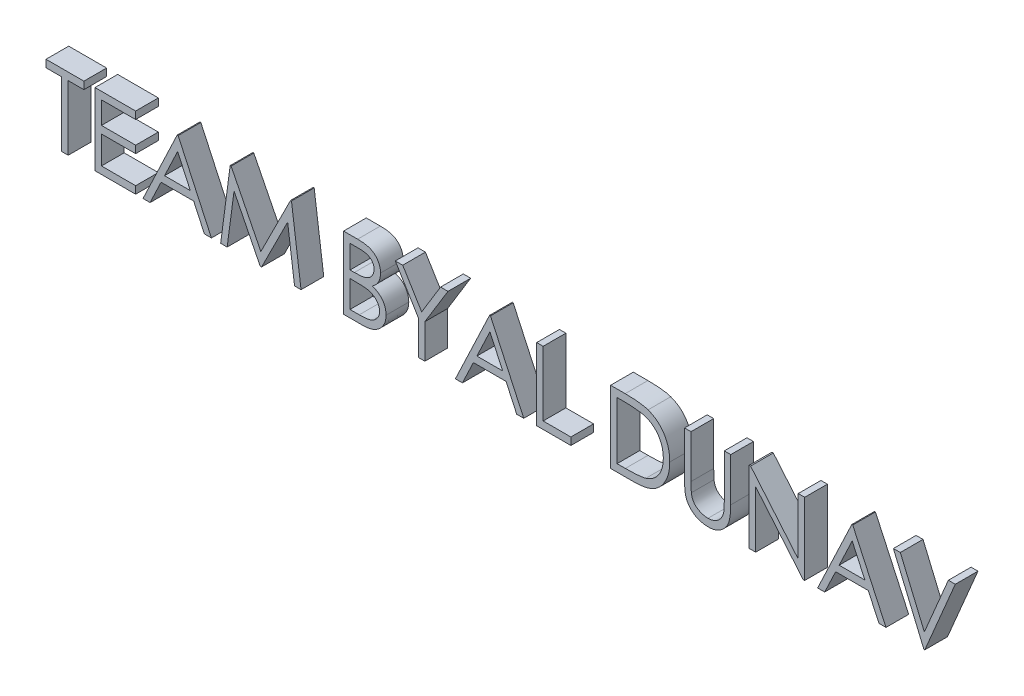
from build123d import *

# Parameters (mm, degrees)
BOSS_EXTRUDE3_DEPTH    = 3
BOSS_EXTRUDE3_2_DEPTH  = 3
BOSS_EXTRUDE3_3_DEPTH  = 3
BOSS_EXTRUDE3_4_DEPTH  = 3
BOSS_EXTRUDE3_5_DEPTH  = 3
BOSS_EXTRUDE3_6_DEPTH  = 3
BOSS_EXTRUDE3_7_DEPTH  = 3
BOSS_EXTRUDE3_8_DEPTH  = 3
BOSS_EXTRUDE3_9_DEPTH  = 3
BOSS_EXTRUDE3_10_DEPTH = 3
BOSS_EXTRUDE3_11_DEPTH = 3
BOSS_EXTRUDE3_12_DEPTH = 3
BOSS_EXTRUDE3_13_DEPTH = 3


with BuildPart() as part:
    # Sketch5 → Boss-Extrude3 (new body)
    with BuildSketch(Plane.XY):
        Polygon((51.715865385, 3.905), (52.631730769, 3.905), (55.806730769, -3.601280048), (58.981730769, 3.905), (59.897596154, 3.905), (55.867788462, -5.62), (55.745673077, -5.62), align=None)
    extrude(amount=BOSS_EXTRUDE3_DEPTH)


with BuildPart() as body_2:
    # Sketch5 → Boss-Extrude3 2 (new body)
    with BuildSketch(Plane.XY):
        Polygon((46.342788462, 3.905), (50.738942308, -5.62), (49.809720553, -5.62), (48.401577524, -2.567115385), (44.083653846, -2.567115385), (42.635441707, -5.62), (41.702403846, -5.62), (46.220673077, 3.905), align=None)
        Polygon((46.272190505, 2.048464543), (44.547310697, -1.590192308), (47.951277043, -1.590192308), align=None, mode=Mode.SUBTRACT)
    extrude(amount=BOSS_EXTRUDE3_2_DEPTH)


with BuildPart() as body_3:
    # Sketch5 → Boss-Extrude3 3 (new body)
    with BuildSketch(Plane.XY):
        Polygon((32.665865385, -5.62), (32.665865385, 3.905), (32.845222356, 3.905), (39.137980769, -3.591739784), (39.137980769, 3.905), (39.992788462, 3.905), (39.992788462, -5.62), (39.798167067, -5.62), (33.520673077, 1.859567308), (33.520673077, -5.62), align=None)
    extrude(amount=BOSS_EXTRUDE3_3_DEPTH)


with BuildPart() as body_4:
    # Sketch5 → Boss-Extrude3 4 (new body)
    with BuildSketch(Plane.XY):
        with BuildLine():
            Line((24.117788462, 3.905), (24.972596154, 3.905))
            Line((24.972596154, 3.905), (24.972596154, -1.801986178))
            add(Edge.make_bspline(
                [(24.972596154, -1.801986178), (24.972468943, -1.88276018), (24.97222754, -2.036042769), (24.973840024, -2.254215073), (24.978355877, -2.448177979), (24.981202925, -2.618679147), (24.987536597, -2.764936195), (24.992701996, -2.887741505), (24.999343797, -2.986513584), (25.007326067, -3.044155962), (25.010757212, -3.068933293)],
                knots=[0, 0, 0, 0, 1.528628734, 2.90083645, 4.128790002, 5.200304208, 6.127813768, 6.898992206, 7.526736466, 8, 8, 8, 8], degree=3))
            add(Edge.make_bspline(
                [(25.010757212, -3.068933293), (25.024847296, -3.158323414), (25.052233539, -3.332066841), (25.122028324, -3.579467236), (25.219503094, -3.802437848), (25.335008804, -4.007936433), (25.48722541, -4.190243191), (25.669570746, -4.358187046), (25.890490244, -4.505067458), (26.136128035, -4.639372167), (26.40088286, -4.747317855), (26.671423521, -4.828942654), (26.943683343, -4.878687374), (27.125954192, -4.884447384), (27.216466346, -4.887307692)],
                knots=[0, 0, 0, 0, 1.035780045, 2.013197591, 2.933192213, 3.817615948, 4.702609284, 5.640816605, 6.646850145, 7.73207398, 8.84249596, 9.914020372, 10.964143139, 12, 12, 12, 12], degree=3))
            add(Edge.make_bspline(
                [(27.216466346, -4.887307692), (27.294173311, -4.884385285), (27.449138426, -4.878557351), (27.679388784, -4.842467314), (27.903634794, -4.777423631), (28.122983787, -4.693495432), (28.328590395, -4.582603773), (28.520569333, -4.454503845), (28.691921183, -4.30425139), (28.84828902, -4.137971167), (28.984455524, -3.950356425), (29.102486988, -3.74549235), (29.199168268, -3.520295913), (29.246911717, -3.362032807), (29.271439303, -3.280727163)],
                knots=[0, 0, 0, 0, 0.994687771, 1.983630487, 2.973142513, 3.978332533, 4.983357753, 5.956394766, 6.925816176, 7.893390482, 8.871859704, 9.88551698, 10.913711441, 12, 12, 12, 12], degree=3))
            add(Edge.make_bspline(
                [(29.271439303, -3.280727163), (29.27960393, -3.2471214), (29.297798008, -3.172234217), (29.314798895, -3.045629848), (29.332505939, -2.896252365), (29.344792019, -2.723028503), (29.356769626, -2.526538713), (29.363935345, -2.305759398), (29.367247414, -2.06149224), (29.368234422, -1.891029679), (29.36875, -1.801986178)],
                knots=[0, 0, 0, 0, 0.558680831, 1.244966039, 2.062412453, 2.990489873, 4.051219941, 5.244515665, 6.560634259, 8, 8, 8, 8], degree=3))
            Line((29.36875, -1.801986178), (29.36875, 3.905))
            Line((29.36875, 3.905), (30.223557692, 3.905))
            Line((30.223557692, 3.905), (30.223557692, -1.847779447))
            add(Edge.make_bspline(
                [(30.223557692, -1.847779447), (30.222866122, -1.951461464), (30.22151648, -2.153803224), (30.209812768, -2.450306565), (30.191151933, -2.731574322), (30.164786494, -2.997644302), (30.129851506, -3.247564406), (30.091002513, -3.48352524), (30.041528213, -3.703833027), (29.983743028, -3.910205535), (29.917684301, -4.106653254), (29.832119461, -4.293094555), (29.735714215, -4.475197314), (29.621374338, -4.650207239), (29.492891933, -4.818899216), (29.347427002, -4.980250198), (29.189790535, -5.136838603), (29.017362019, -5.284647733), (28.832983804, -5.420198489), (28.637204348, -5.539390995), (28.431527567, -5.640148125), (28.216488103, -5.723086177), (27.991994186, -5.785446622), (27.758040157, -5.831915438), (27.514093496, -5.858319548), (27.348182538, -5.862243658), (27.264167668, -5.864230769)],
                knots=[0, 0, 0, 0, 1.316592851, 2.569410997, 3.76748051, 4.895814652, 5.963796859, 6.97159953, 7.931736103, 8.829262218, 9.692595152, 10.560224239, 11.431080259, 12.30701507, 13.211635791, 14.121146779, 15.063487852, 16.031507147, 17.00238618, 17.966455255, 18.938106653, 19.907068911, 20.888905087, 21.893141452, 22.933117798, 24, 24, 24, 24], degree=3))
            add(Edge.make_bspline(
                [(27.264167668, -5.864230769), (27.17253961, -5.862095087), (26.992765689, -5.857904885), (26.727867091, -5.833894401), (26.473919171, -5.788668628), (26.22823982, -5.731083352), (25.994173839, -5.651661896), (25.768585251, -5.558866285), (25.555337697, -5.444900312), (25.350971669, -5.318099721), (25.160948582, -5.175429813), (24.986512078, -5.019926911), (24.827374173, -4.854082027), (24.686217221, -4.676099603), (24.560702528, -4.487363886), (24.45257959, -4.287340954), (24.359742833, -4.076108251), (24.311827818, -3.92927847), (24.287605168, -3.855051082)],
                knots=[0, 0, 0, 0, 1.13879206, 2.234305948, 3.301075583, 4.341971843, 5.366689343, 6.369221514, 7.369726634, 8.367512178, 9.355451585, 10.318319045, 11.268648973, 12.207971039, 13.137398894, 14.081662264, 15.030215811, 16, 16, 16, 16], degree=3))
            add(Edge.make_bspline(
                [(24.287605168, -3.855051082), (24.273515902, -3.804343861), (24.24295597, -3.694358771), (24.210229981, -3.51233197), (24.182718838, -3.302741372), (24.15685014, -3.065572633), (24.141585762, -2.800641924), (24.128203303, -2.508064089), (24.117694184, -2.18748535), (24.117756157, -1.964179847), (24.117788462, -1.847779447)],
                knots=[0, 0, 0, 0, 0.625038921, 1.35572334, 2.194682327, 3.136881307, 4.189498639, 5.346923369, 6.617055217, 8, 8, 8, 8], degree=3))
            Line((24.117788462, -1.847779447), (24.117788462, 3.905))
        make_face()
    extrude(amount=BOSS_EXTRUDE3_4_DEPTH)


with BuildPart() as body_5:
    # Sketch5 → Boss-Extrude3 5 (new body)
    with BuildSketch(Plane.XY):
        with BuildLine():
            Line((14.348557692, -5.62), (14.348557692, 3.905))
            Line((14.348557692, 3.905), (16.271875, 3.905))
            add(Edge.make_bspline(
                [(16.271875, 3.905), (16.439158461, 3.903795577), (16.762349236, 3.901468639), (17.229380254, 3.88671471), (17.661498922, 3.860614943), (18.05728406, 3.822597875), (18.417822215, 3.775917119), (18.742103856, 3.717405305), (19.031805759, 3.648313212), (19.209976165, 3.589406666), (19.294230769, 3.561550481)],
                knots=[0, 0, 0, 0, 1.314313732, 2.53924729, 3.670748893, 4.714932338, 5.66265055, 6.526160246, 7.303039223, 8, 8, 8, 8], degree=3))
            add(Edge.make_bspline(
                [(19.294230769, 3.561550481), (19.40443431, 3.519556918), (19.62234234, 3.436522066), (19.932604581, 3.279886703), (20.22468289, 3.102413905), (20.500143563, 2.903869735), (20.752694383, 2.678632473), (20.992201588, 2.436269975), (21.208867372, 2.16796885), (21.407282092, 1.879293347), (21.586176994, 1.573644119), (21.741677131, 1.251603573), (21.870819784, 0.914807171), (21.978025636, 0.564191518), (22.062516353, 0.198985661), (22.120161467, -0.181235645), (22.158182518, -0.574969725), (22.162003543, -0.842144516), (22.163942308, -0.977707332)],
                knots=[0, 0, 0, 0, 0.984719456, 1.947108742, 2.898477687, 3.838006223, 4.779231079, 5.722358779, 6.681677486, 7.655904652, 8.64651281, 9.637519902, 10.640069247, 11.656948941, 12.698408672, 13.768548281, 14.867775369, 16, 16, 16, 16], degree=3))
            add(Edge.make_bspline(
                [(22.163942308, -0.977707332), (22.162230618, -1.095439702), (22.158857554, -1.327443635), (22.128569915, -1.669366358), (22.084547216, -2.001145434), (22.01639122, -2.321200947), (21.933652952, -2.632337025), (21.827614797, -2.931237633), (21.706142482, -3.220644714), (21.564492456, -3.496645131), (21.408986258, -3.758129165), (21.242103514, -4.004623996), (21.064022222, -4.232612278), (20.873044249, -4.442784429), (20.671637535, -4.63482361), (20.458483464, -4.810334024), (20.233032019, -4.965881505), (19.99629298, -5.107578421), (19.741360086, -5.231186674), (19.463404621, -5.335771201), (19.161241201, -5.42243949), (18.835611504, -5.494750285), (18.485952897, -5.552110658), (18.111922569, -5.590554626), (17.714095187, -5.61655225), (17.440920187, -5.618828435), (17.300315505, -5.62)],
                knots=[0, 0, 0, 0, 1.105936401, 2.179363191, 3.223086493, 4.248585256, 5.251745608, 6.245858792, 7.225916811, 8.198733463, 9.158002045, 10.082870192, 10.993790845, 11.873723703, 12.748670949, 13.606408763, 14.465103618, 15.319838547, 16.196477973, 17.123216899, 18.106603292, 19.147568657, 20.255746949, 21.433717677, 22.679120308, 24, 24, 24, 24], degree=3))
            Line((17.300315505, -5.62), (14.348557692, -5.62))
        make_face()
        with BuildLine():
            Line((15.203365385, -4.643076923), (16.296679687, -4.643076923))
            add(Edge.make_bspline(
                [(16.296679687, -4.643076923), (16.453783325, -4.642401747), (16.755951155, -4.641103135), (17.19044899, -4.62970796), (17.587449348, -4.611088116), (17.947008599, -4.585030226), (18.268923729, -4.550553495), (18.553867505, -4.512113581), (18.800905887, -4.464223375), (18.950392426, -4.420813979), (19.019471154, -4.400754207)],
                knots=[0, 0, 0, 0, 1.375205317, 2.645023457, 3.804390687, 4.853969522, 5.800190428, 6.637939096, 7.370582563, 8, 8, 8, 8], degree=3))
            add(Edge.make_bspline(
                [(19.019471154, -4.400754207), (19.106416339, -4.370133895), (19.278230026, -4.309624636), (19.525556408, -4.199249858), (19.756216542, -4.068506797), (19.974230254, -3.923176323), (20.176504937, -3.75813256), (20.365437711, -3.576964369), (20.540648185, -3.378749731), (20.700326123, -3.163734663), (20.843223722, -2.933257433), (20.966970425, -2.689583893), (21.075423521, -2.435383931), (21.160545977, -2.166754006), (21.227263388, -1.88609564), (21.274520146, -1.593389089), (21.303951646, -1.288689014), (21.307384587, -1.081446448), (21.309134615, -0.975799279)],
                knots=[0, 0, 0, 0, 0.998632004, 1.973411704, 2.929992603, 3.868527914, 4.809262121, 5.754881198, 6.702106254, 7.672490631, 8.653608572, 9.636854334, 10.631411391, 11.644891563, 12.686317036, 13.754757253, 14.855430412, 16, 16, 16, 16], degree=3))
            add(Edge.make_bspline(
                [(21.309134615, -0.975799279), (21.30773774, -0.864401736), (21.304993567, -0.645560277), (21.270501337, -0.324457028), (21.220096247, -0.015627543), (21.147206358, 0.280948831), (21.054321609, 0.565850704), (20.938403334, 0.837502371), (20.805960606, 1.098772764), (20.648380811, 1.343631574), (20.475799803, 1.575206392), (20.284271432, 1.787355127), (20.076838598, 1.980561044), (19.855763758, 2.157833031), (19.614816366, 2.312039177), (19.359672393, 2.449979359), (19.086588817, 2.567044035), (18.896598552, 2.629307226), (18.800045072, 2.660949519)],
                knots=[0, 0, 0, 0, 1.122418816, 2.205001699, 3.251619955, 4.274784885, 5.280384055, 6.268708349, 7.249350384, 8.229342522, 9.199999885, 10.157847722, 11.105861043, 12.055065948, 13.010012805, 13.98527497, 14.976112212, 16, 16, 16, 16], degree=3))
            add(Edge.make_bspline(
                [(18.800045072, 2.660949519), (18.720168024, 2.683037798), (18.550327503, 2.730003539), (18.273178676, 2.781235445), (17.961261734, 2.826423404), (17.613191833, 2.864681353), (17.22936574, 2.892133278), (16.809488261, 2.91273807), (16.353377909, 2.926635405), (16.037195441, 2.927584387), (15.873091947, 2.928076923)],
                knots=[0, 0, 0, 0, 0.674548936, 1.434276114, 2.292660221, 3.240891867, 4.284742987, 5.42552168, 6.663806718, 8, 8, 8, 8], degree=3))
            Line((15.873091947, 2.928076923), (15.203365385, 2.928076923))
            Line((15.203365385, 2.928076923), (15.203365385, -4.643076923))
        make_face(mode=Mode.SUBTRACT)
    extrude(amount=BOSS_EXTRUDE3_5_DEPTH)


with BuildPart() as body_6:
    # Sketch5 → Boss-Extrude3 6 (new body)
    with BuildSketch(Plane.XY):
        Polygon((4.579326923, 3.905), (5.434134615, 3.905), (5.434134615, -4.643076923), (9.097596154, -4.643076923), (9.097596154, -5.62), (4.579326923, -5.62), align=None)
    extrude(amount=BOSS_EXTRUDE3_6_DEPTH)


with BuildPart() as body_7:
    # Sketch5 → Boss-Extrude3 7 (new body)
    with BuildSketch(Plane.XY):
        Polygon((-1.526442308, 3.905), (2.869711538, -5.62), (1.940489784, -5.62), (0.532346755, -2.567115385), (-3.785576923, -2.567115385), (-5.233789062, -5.62), (-6.166826923, -5.62), (-1.648557692, 3.905), align=None)
        Polygon((-1.597040264, 2.048464543), (-3.321920072, -1.590192308), (0.082046274, -1.590192308), align=None, mode=Mode.SUBTRACT)
    extrude(amount=BOSS_EXTRUDE3_7_DEPTH)


with BuildPart() as body_8:
    # Sketch5 → Boss-Extrude3 8 (new body)
    with BuildSketch(Plane.XY):
        Polygon((-14.104326923, 3.905), (-13.125495793, 3.905), (-10.622130409, -0.187773437), (-8.12258113, 3.905), (-7.14375, 3.905), (-10.196634615, -1.092190505), (-10.196634615, -5.62), (-11.051442308, -5.62), (-11.051442308, -1.092190505), align=None)
    extrude(amount=BOSS_EXTRUDE3_8_DEPTH)


with BuildPart() as body_9:
    # Sketch5 → Boss-Extrude3 9 (new body)
    with BuildSketch(Plane.XY):
        with BuildLine():
            Line((-20.942788462, 3.905), (-19.084344952, 3.905))
            add(Edge.make_bspline(
                [(-19.084344952, 3.905), (-18.993371736, 3.904521708), (-18.817043003, 3.903594659), (-18.560631522, 3.889216995), (-18.320468688, 3.869612722), (-18.09648485, 3.838506541), (-17.88878351, 3.800973204), (-17.696738726, 3.755520405), (-17.520961185, 3.701019406), (-17.311104381, 3.614352027), (-17.071834583, 3.485565404), (-16.812758957, 3.295259809), (-16.591223134, 3.06248932), (-16.400216085, 2.799918665), (-16.248357324, 2.511077743), (-16.138495165, 2.202850951), (-16.068941232, 1.879213925), (-16.061788136, 1.657027848), (-16.058173077, 1.544738582)],
                knots=[0, 0, 0, 0, 1.001505555, 1.941167018, 2.826882275, 3.653841531, 4.429895133, 5.150066043, 5.825578002, 6.45369114, 7.647487171, 8.808567382, 9.977351308, 11.170798116, 12.373658725, 13.556498008, 14.765093433, 16, 16, 16, 16], degree=3))
            add(Edge.make_bspline(
                [(-16.058173077, 1.544738582), (-16.061148193, 1.439548412), (-16.066994576, 1.23283981), (-16.122900228, 0.930505126), (-16.21042319, 0.642710738), (-16.332085333, 0.370506961), (-16.490205765, 0.120044056), (-16.677598761, -0.110698432), (-16.903686345, -0.311950951), (-17.073076877, -0.424462708), (-17.159119591, -0.481613582)],
                knots=[0, 0, 0, 0, 1.044552857, 2.05264487, 3.044412934, 4.028983338, 5.005914585, 5.980388656, 6.974128949, 8, 8, 8, 8], degree=3))
            add(Edge.make_bspline(
                [(-17.159119591, -0.481613582), (-17.050914428, -0.523156186), (-16.843891145, -0.602637479), (-16.55899564, -0.743159706), (-16.313536812, -0.896000878), (-16.105627436, -1.062911127), (-15.927815675, -1.242821534), (-15.77255017, -1.438370094), (-15.640067287, -1.652107714), (-15.526548545, -1.881805907), (-15.437969431, -2.125119224), (-15.371632148, -2.379765408), (-15.333620733, -2.64483134), (-15.328211509, -2.825222265), (-15.325480769, -2.916289062)],
                knots=[0, 0, 0, 0, 1.27268992, 2.434971085, 3.483601985, 4.442670788, 5.356604649, 6.2567628, 7.179492994, 8.113709626, 9.066344395, 10.018646069, 10.999752585, 12, 12, 12, 12], degree=3))
            add(Edge.make_bspline(
                [(-15.325480769, -2.916289062), (-15.328139186, -3.009271764), (-15.333369695, -3.192217836), (-15.371959476, -3.46097288), (-15.437298545, -3.717807557), (-15.527299308, -3.964383089), (-15.644762464, -4.200222455), (-15.787713567, -4.425592838), (-15.958160894, -4.638229838), (-16.148831987, -4.840496269), (-16.364538254, -5.022363319), (-16.597263273, -5.184331064), (-16.849937901, -5.317534276), (-17.118412256, -5.429428591), (-17.405698002, -5.514901039), (-17.710505098, -5.574697829), (-18.032570662, -5.61498868), (-18.253577199, -5.618301216), (-18.366917067, -5.62)],
                knots=[0, 0, 0, 0, 0.978564426, 1.925352924, 2.850884081, 3.763762016, 4.682927383, 5.618979971, 6.567305752, 7.547517671, 8.540179244, 9.531824382, 10.526200242, 11.540722885, 12.589160233, 13.674978461, 14.80764778, 16, 16, 16, 16], degree=3))
            Line((-18.366917067, -5.62), (-20.942788462, -5.62))
            Line((-20.942788462, -5.62), (-20.942788462, 3.905))
        make_face()
        with BuildLine():
            Line((-20.087980769, 2.928076923), (-20.087980769, -0.124807692))
            Line((-20.087980769, -0.124807692), (-19.513656851, -0.124807692))
            add(Edge.make_bspline(
                [(-19.513656851, -0.124807692), (-19.429704058, -0.12371933), (-19.267490153, -0.121616393), (-19.03257672, -0.115592465), (-18.814522206, -0.098724932), (-18.613703004, -0.081862248), (-18.430435353, -0.054444977), (-18.265125272, -0.021809271), (-18.115178376, 0.012706349), (-17.942260042, 0.071406167), (-17.746118661, 0.158158983), (-17.537022856, 0.292793051), (-17.352688335, 0.45315147), (-17.197030274, 0.638184016), (-17.069636201, 0.841926993), (-16.981152447, 1.061129575), (-16.921152338, 1.290328648), (-16.915732528, 1.447676893), (-16.912980769, 1.527566106)],
                knots=[0, 0, 0, 0, 1.156816544, 2.235205308, 3.236616184, 4.169592532, 5.011045266, 5.787822928, 6.49130361, 7.128639758, 8.301311294, 9.436451833, 10.541879658, 11.654887649, 12.756523258, 13.837046038, 14.901820046, 16, 16, 16, 16], degree=3))
            add(Edge.make_bspline(
                [(-16.912980769, 1.527566106), (-16.914412731, 1.580431955), (-16.91722168, 1.684134092), (-16.94022674, 1.835307692), (-16.979327067, 1.977485333), (-17.029549108, 2.112615447), (-17.099731182, 2.236472697), (-17.182363179, 2.353339536), (-17.282200665, 2.459236087), (-17.395840208, 2.558213079), (-17.526492246, 2.645964258), (-17.674078833, 2.722819478), (-17.840596726, 2.784706878), (-18.023239567, 2.838907264), (-18.224818741, 2.876975407), (-18.443008061, 2.908689269), (-18.679594689, 2.924834802), (-18.84327529, 2.926972111), (-18.927884615, 2.928076923)],
                knots=[0, 0, 0, 0, 0.91205012, 1.789085906, 2.630437955, 3.453916878, 4.269457761, 5.079663411, 5.91843418, 6.774407191, 7.675494373, 8.627863946, 9.638891023, 10.736472738, 11.911756761, 13.175263542, 14.539845004, 16, 16, 16, 16], degree=3))
            Line((-18.927884615, 2.928076923), (-20.087980769, 2.928076923))
        make_face(mode=Mode.SUBTRACT)
        with BuildLine():
            Line((-20.087980769, -1.101730769), (-20.087980769, -4.643076923))
            Line((-20.087980769, -4.643076923), (-18.870643029, -4.643076923))
            add(Edge.make_bspline(
                [(-18.870643029, -4.643076923), (-18.783505809, -4.642032582), (-18.615560305, -4.640019752), (-18.373077672, -4.633448714), (-18.148333654, -4.618501878), (-17.942353799, -4.594972816), (-17.752913924, -4.569450036), (-17.582286604, -4.535129336), (-17.429088699, -4.495807522), (-17.251449332, -4.435026668), (-17.051414785, -4.340602701), (-16.835848097, -4.19823327), (-16.644188175, -4.02862484), (-16.481432434, -3.832325709), (-16.348047086, -3.618880455), (-16.251013312, -3.392606324), (-16.191166766, -3.157242139), (-16.183921863, -2.996768442), (-16.180288462, -2.916289062)],
                knots=[0, 0, 0, 0, 1.160039823, 2.235823828, 3.228722157, 4.157150951, 4.99529583, 5.772374946, 6.472645482, 7.099169577, 8.269452708, 9.405989375, 10.527446681, 11.663510218, 12.788923519, 13.866172445, 14.929861265, 16, 16, 16, 16], degree=3))
            add(Edge.make_bspline(
                [(-16.180288462, -2.916289062), (-16.18103986, -2.865960757), (-16.182530536, -2.766115947), (-16.20501121, -2.619387896), (-16.237706098, -2.477258912), (-16.279973786, -2.339343061), (-16.34153105, -2.208133801), (-16.413394576, -2.081036122), (-16.497653819, -1.95788201), (-16.628946871, -1.802182949), (-16.819914914, -1.622794506), (-17.091259782, -1.447160304), (-17.399794393, -1.305515914), (-17.623570641, -1.245373768), (-17.739167668, -1.214305889)],
                knots=[0, 0, 0, 0, 0.723448775, 1.435228256, 2.130040452, 2.821711965, 3.505591119, 4.210454504, 4.921174351, 5.648778258, 7.137944449, 8.670945889, 10.280296675, 12, 12, 12, 12], degree=3))
            add(Edge.make_bspline(
                [(-17.739167668, -1.214305889), (-17.785511136, -1.204903125), (-17.885993334, -1.184515993), (-18.049843964, -1.162995743), (-18.236903721, -1.143823116), (-18.447604551, -1.129641322), (-18.682213033, -1.114982229), (-18.941230219, -1.109281323), (-19.22359834, -1.102479765), (-19.419520439, -1.101986821), (-19.521289063, -1.101730769)],
                knots=[0, 0, 0, 0, 0.634451884, 1.375622551, 2.216452059, 3.157844607, 4.20941857, 5.370758133, 6.634282058, 8, 8, 8, 8], degree=3))
            Line((-19.521289063, -1.101730769), (-20.087980769, -1.101730769))
        make_face(mode=Mode.SUBTRACT)
    extrude(amount=BOSS_EXTRUDE3_9_DEPTH)


with BuildPart() as body_10:
    # Sketch5 → Boss-Extrude3 10 (new body)
    with BuildSketch(Plane.XY):
        Polygon((-37.184134615, -5.62), (-35.926727764, 3.905), (-35.80461238, 3.905), (-31.872115385, -3.910384615), (-27.949158654, 3.905), (-27.825135216, 3.905), (-26.560096154, -5.62), (-27.418719952, -5.62), (-28.330769231, 1.233725962), (-31.769080529, -5.62), (-31.96179387, -5.62), (-35.413461538, 1.248990385), (-36.323602764, -5.62), align=None)
    extrude(amount=BOSS_EXTRUDE3_10_DEPTH)


with BuildPart() as body_11:
    # Sketch5 → Boss-Extrude3 11 (new body)
    with BuildSketch(Plane.XY):
        Polygon((-42.801442308, 3.905), (-38.405288462, -5.62), (-39.334510216, -5.62), (-40.742653245, -2.567115385), (-45.060576923, -2.567115385), (-46.508789062, -5.62), (-47.441826923, -5.62), (-42.923557692, 3.905), align=None)
        Polygon((-42.872040264, 2.048464543), (-44.596920072, -1.590192308), (-41.192953726, -1.590192308), align=None, mode=Mode.SUBTRACT)
    extrude(amount=BOSS_EXTRUDE3_11_DEPTH)


with BuildPart() as body_12:
    # Sketch5 → Boss-Extrude3 12 (new body)
    with BuildSketch(Plane.XY):
        Polygon((-53.791826923, 3.905), (-48.41875, 3.905), (-48.41875, 2.928076923), (-52.937019231, 2.928076923), (-52.937019231, -0.002692308), (-48.41875, -0.002692308), (-48.41875, -0.979615385), (-52.937019231, -0.979615385), (-52.937019231, -4.643076923), (-48.41875, -4.643076923), (-48.41875, -5.62), (-53.791826923, -5.62), align=None)
    extrude(amount=BOSS_EXTRUDE3_12_DEPTH)


with BuildPart() as body_13:
    # Sketch5 → Boss-Extrude3 13 (new body)
    with BuildSketch(Plane.XY):
        Polygon((-60.263942308, 2.928076923), (-60.263942308, 3.905), (-55.257211538, 3.905), (-55.257211538, 2.928076923), (-57.333173077, 2.928076923), (-57.333173077, -5.62), (-58.187980769, -5.62), (-58.187980769, 2.928076923), align=None)
    extrude(amount=BOSS_EXTRUDE3_13_DEPTH)


solid = Compound([part.part, body_2.part, body_3.part, body_4.part, body_5.part, body_6.part, body_7.part, body_8.part, body_9.part, body_10.part, body_11.part, body_12.part, body_13.part])
